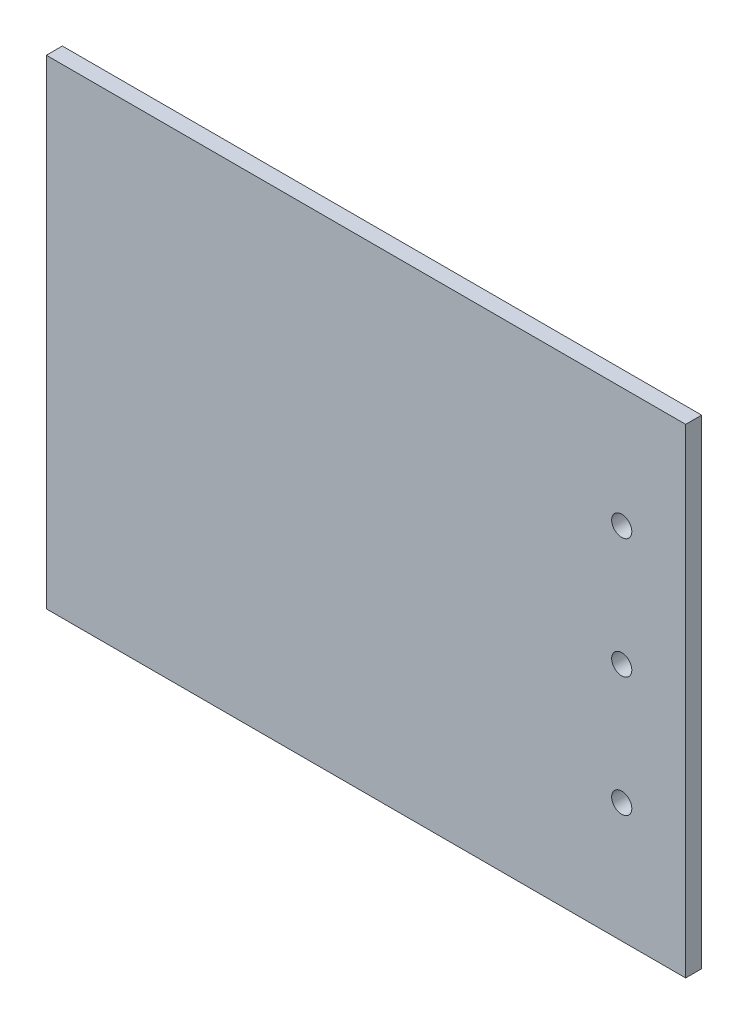
from build123d import *

# Parameters (mm, degrees)
SKETCH2_W           = 200
SKETCH2_H           = 150
BOSS_EXTRUDE1_DEPTH = 5
SKETCH3_R           = 3.15
CUT_EXTRUDE1_DEPTH  = 5


with BuildPart() as part:
    # Sketch2 → Boss-Extrude1 (new body)
    with BuildSketch(Plane.XY):
        with Locations((-123.584758496, -75)):
            Rectangle(SKETCH2_W, SKETCH2_H)
    extrude(amount=BOSS_EXTRUDE1_DEPTH)

    # Sketch3 → Cut-Extrude1 (cut)
    with BuildSketch(Plane(origin=(0, 0, 0), x_dir=(-1, 0, 0), z_dir=(0, 0, -1))):
        with Locations((43.584758496, -37.5)):
            Circle(SKETCH3_R)
        with Locations((43.584758496, -75)):
            Circle(SKETCH3_R)
        with Locations((43.584758496, -112.5)):
            Circle(SKETCH3_R)
    extrude(amount=-CUT_EXTRUDE1_DEPTH, mode=Mode.SUBTRACT)


solid = part.part
